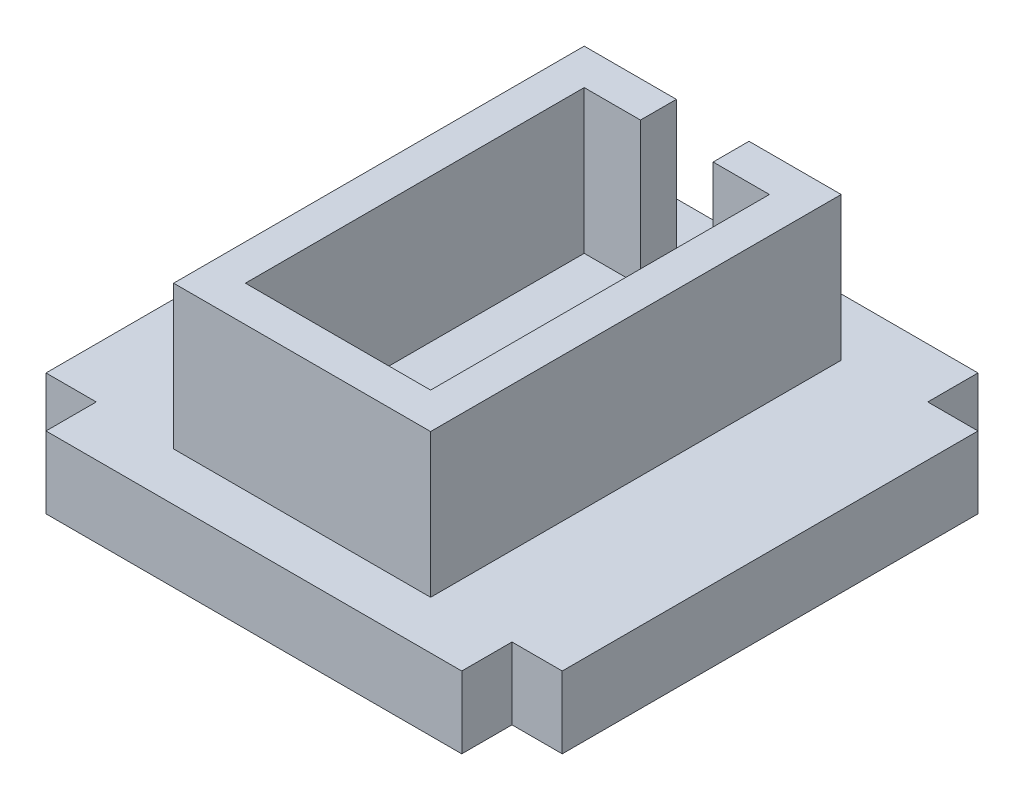
from build123d import *

# Parameters (mm, degrees)
BOSS_EXTRUDE18_DEPTH = 5
BOSS_EXTRUDE19_DEPTH = 10


with BuildPart() as part:
    # Sketch21 → Boss-Extrude18 (new body)
    with BuildSketch(Plane(origin=(0, 0, 0), x_dir=(1, 0, 0), z_dir=(0, 1, 0))):
        Polygon((0, 17.98), (-14.48, 17.98), (-14.48, 14.48), (-17.98, 14.48), (-17.98, 0), (-17.98, -14.48), (-14.48, -14.48), (-14.48, -17.98), (0, -17.98), (14.48, -17.98), (14.48, -14.48), (17.98, -14.48), (17.98, 0), (17.98, 14.48), (14.48, 14.48), (14.48, 17.98), align=None)
    extrude(amount=BOSS_EXTRUDE18_DEPTH)

    # Sketch23 → Boss-Extrude19 (add)
    with BuildSketch(Plane(origin=(0, 5, 0), x_dir=(1, 0, 0), z_dir=(0, 1, 0))):
        Polygon((-8.95, 13.98), (-2.53, 13.98), (-2.53, 11.48), (-6.45, 11.48), (-6.45, -12.12), (6.45, -12.12), (6.45, 11.48), (2.53, 11.48), (2.53, 13.98), (8.95, 13.98), (8.95, -14.62), (-8.95, -14.62), align=None)
    extrude(amount=BOSS_EXTRUDE19_DEPTH)


solid = part.part
